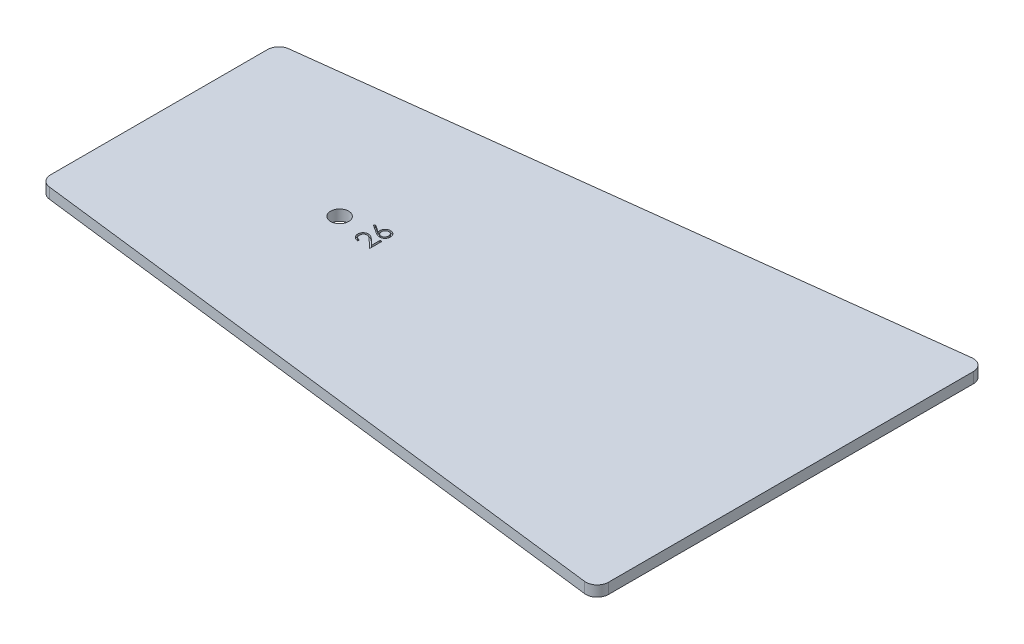
from build123d import *

# Parameters (mm, degrees)
BOSS_EXTRUDE1_DEPTH   = 5.9944
SKETCH2_R             = 5.08
CUT_EXTRUDE1_DEPTH    = 373.229628686
CUT_EXTRUDE2_DEPTH    = 1.27
FILLET1_R             = 6.35
BODY_MOVE_COPY1_ANGLE = 90


with BuildPart() as part:
    # Sketch1 → Boss-Extrude1 (new body)
    with BuildSketch(Plane(origin=(0, 0, 0), x_dir=(1, 0, 0), z_dir=(0, 1, 0))):
        Polygon((-66.675, 0), (66.675, 0), (109.852645123, -355.6), (-109.852645123, -355.6), align=None)
    extrude(amount=BOSS_EXTRUDE1_DEPTH)

    # Sketch2 → Cut-Extrude1 (cut, through all)
    with BuildSketch(Plane(origin=(0, 5.9944, 0), x_dir=(1, 0, 0), z_dir=(0, 1, 0))):
        with Locations(Location((0, -101.6, 0), (0, 0, 270))):
            Circle(SKETCH2_R)
    extrude(amount=-CUT_EXTRUDE1_DEPTH, mode=Mode.SUBTRACT)

    # Sketch3 → Cut-Extrude2 (cut)
    # profile 1 of 2: a face of its own
    with BuildSketch(Plane(origin=(0, 5.9944, 0), x_dir=(1, 0, 0), z_dir=(0, 1, 0))):
        with BuildLine():
            Line((-5.926666667, -118.696153846), (-6.838461538, -118.696153846))
            add(Edge.make_bspline(
                [(-6.838461538, -118.696153846), (-6.832518946, -118.575189212), (-6.820847852, -118.33761789), (-6.766192018, -117.991237636), (-6.6879865, -117.660152848), (-6.577412451, -117.347021898), (-6.440089084, -117.049076104), (-6.275409919, -116.767498915), (-6.08035577, -116.503364493), (-5.859138508, -116.259121451), (-5.618872973, -116.03505696), (-5.359630589, -115.841566312), (-5.087211881, -115.678084157), (-4.80244334, -115.541414038), (-4.502112104, -115.438827514), (-4.188943579, -115.36270984), (-3.861561858, -115.316913362), (-3.638506251, -115.311990739), (-3.525064103, -115.309487179)],
                knots=[0, 0, 0, 0, 1.10065271, 2.161652631, 3.183658789, 4.190468796, 5.17591951, 6.163126047, 7.15150782, 8.156236427, 9.156009102, 10.134482811, 11.092018607, 12.041330605, 13.001268258, 13.972401359, 14.968799086, 16, 16, 16, 16], degree=3))
            add(Edge.make_bspline(
                [(-3.525064103, -115.309487179), (-3.413658036, -115.31209527), (-3.194749095, -115.317220075), (-2.87525479, -115.361230377), (-2.571101273, -115.430160438), (-2.28288307, -115.526870332), (-2.012899751, -115.656873127), (-1.759123142, -115.813039696), (-1.518531988, -115.993654978), (-1.301959154, -116.206300334), (-1.103089987, -116.433310684), (-0.931524583, -116.675664141), (-0.7846018, -116.925975439), (-0.662136992, -117.186153305), (-0.571985457, -117.45864749), (-0.503541288, -117.739490799), (-0.46485371, -118.03159025), (-0.458916138, -118.229293851), (-0.455897436, -118.329807692)],
                knots=[0, 0, 0, 0, 1.111607364, 2.184268762, 3.212621178, 4.221274766, 5.211760367, 6.196651075, 7.1921475, 8.207485113, 9.220403448, 10.201281604, 11.166441695, 12.114753415, 13.065576456, 14.026450734, 14.996634279, 16, 16, 16, 16], degree=3))
            add(Edge.make_bspline(
                [(-0.455897436, -118.329807692), (-0.460812736, -118.471315692), (-0.47055708, -118.751848427), (-0.553910813, -119.164097285), (-0.684093828, -119.563511325), (-0.840840441, -119.884965893), (-0.998966164, -120.143997978), (-1.141460186, -120.357267133), (-1.308272324, -120.586899007), (-1.501830478, -120.832124649), (-1.718130701, -121.094864876), (-1.959132181, -121.374960968), (-2.226553489, -121.66951902), (-2.414247879, -121.87070328), (-2.51150641, -121.974951923)],
                knots=[0, 0, 0, 0, 1.184426356, 2.348067706, 3.509069118, 4.696110526, 5.333549288, 6.050745305, 6.844228056, 7.710549037, 8.667450064, 9.695053472, 10.805634456, 12, 12, 12, 12], degree=3))
            Line((-2.51150641, -121.974951923), (-5.053541667, -124.687948718))
            Line((-5.053541667, -124.687948718), (-0.325641026, -124.687948718))
            Line((-0.325641026, -124.687948718), (-0.325641026, -125.73))
            Line((-0.325641026, -125.73), (-7.229230769, -125.73))
            Line((-7.229230769, -125.73), (-3.288974359, -121.525160256))
            add(Edge.make_bspline(
                [(-3.288974359, -121.525160256), (-3.193041065, -121.425016601), (-3.00877284, -121.232661133), (-2.748146845, -120.951830141), (-2.514063382, -120.691300045), (-2.305007179, -120.451563093), (-2.125513346, -120.229112599), (-1.966227096, -120.031153117), (-1.838601266, -119.848985912), (-1.700090289, -119.637830302), (-1.565937703, -119.380020832), (-1.450658406, -119.064963037), (-1.380366161, -118.740634784), (-1.371933838, -118.521463156), (-1.367692308, -118.411217949)],
                knots=[0, 0, 0, 0, 1.329631726, 2.553950428, 3.673215718, 4.687767853, 5.603093632, 6.413772471, 7.123043292, 7.734684054, 8.834405432, 9.900288307, 10.943827018, 12, 12, 12, 12], degree=3))
            add(Edge.make_bspline(
                [(-1.367692308, -118.411217949), (-1.369537777, -118.341893661), (-1.373174842, -118.205268801), (-1.405273758, -118.004954941), (-1.45378197, -117.811726796), (-1.523291633, -117.624990004), (-1.615041485, -117.446622054), (-1.72672421, -117.276405826), (-1.855582223, -117.111845858), (-2.004647622, -116.957549427), (-2.168402205, -116.816234842), (-2.341395798, -116.691051783), (-2.524421244, -116.586435393), (-2.716706856, -116.500674841), (-2.917716561, -116.43340002), (-3.127839135, -116.386784258), (-3.346493994, -116.357516248), (-3.495798085, -116.353556251), (-3.571875, -116.351538462)],
                knots=[0, 0, 0, 0, 0.991446411, 1.95395049, 2.89581595, 3.838931463, 4.798493298, 5.75982156, 6.748411868, 7.785213223, 8.824556874, 9.840280684, 10.836137867, 11.835679398, 12.848801643, 13.863922112, 14.911575587, 16, 16, 16, 16], degree=3))
            add(Edge.make_bspline(
                [(-3.571875, -116.351538462), (-3.651328617, -116.353614098), (-3.807362403, -116.357690305), (-4.036453081, -116.386204096), (-4.254996938, -116.43539545), (-4.46354372, -116.502674024), (-4.662446289, -116.588187983), (-4.850737342, -116.694698876), (-5.027994187, -116.821796102), (-5.194550037, -116.965895546), (-5.348006616, -117.126329497), (-5.482835262, -117.305174418), (-5.600644857, -117.499164858), (-5.703432803, -117.707777382), (-5.786906464, -117.932904926), (-5.85069138, -118.173748321), (-5.901162913, -118.429261817), (-5.918024218, -118.605712234), (-5.926666667, -118.696153846)],
                knots=[0, 0, 0, 0, 1.031018746, 2.02475058, 2.990194455, 3.934040569, 4.864654155, 5.795059489, 6.735614925, 7.690564532, 8.649604399, 9.611025574, 10.590972636, 11.591080095, 12.624614302, 13.701020113, 14.821632451, 16, 16, 16, 16], degree=3))
        make_face()
    # profile 2 of 2: a face of its own
    with BuildSketch(Plane(origin=(0, 5.9944, 0), x_dir=(1, 0, 0), z_dir=(0, 1, 0))):
        with BuildLine():
            Line((5.275384615, -115.309487179), (5.977548077, -115.861041667))
            Line((5.977548077, -115.861041667), (3.293044872, -119.966153846))
            add(Edge.make_bspline(
                [(3.293044872, -119.966153846), (3.47177459, -119.937665611), (3.820407114, -119.882096086), (4.173295551, -119.872929022), (4.345272436, -119.868461538)],
                knots=[0, 0, 0, 0, 1.025318673, 2, 2, 2, 2], degree=3))
            add(Edge.make_bspline(
                [(4.345272436, -119.868461538), (4.448534311, -119.871236994), (4.651802239, -119.876700396), (4.950235699, -119.918744945), (5.237005868, -119.985002985), (5.510924148, -120.08158759), (5.772973718, -120.204965853), (6.024658388, -120.352834117), (6.26124708, -120.532827749), (6.485786503, -120.733894021), (6.689645734, -120.956592467), (6.870133941, -121.192888919), (7.021740857, -121.44253719), (7.144746298, -121.705410836), (7.24026446, -121.98110464), (7.309897166, -122.269265868), (7.351058499, -122.570093225), (7.356647923, -122.7746813), (7.359487179, -122.878605769)],
                knots=[0, 0, 0, 0, 1.04369286, 2.054478336, 3.041073146, 4.015093852, 4.984733326, 5.965804835, 6.960378782, 7.985147595, 9.009457201, 10.008161701, 10.986880575, 11.956520048, 12.937015923, 13.931873656, 14.949455224, 16, 16, 16, 16], degree=3))
            add(Edge.make_bspline(
                [(7.359487179, -122.878605769), (7.355356109, -123.020786853), (7.347227141, -123.300565577), (7.266226407, -123.708059102), (7.140359553, -124.09626549), (6.960447642, -124.458986696), (6.736978781, -124.795725583), (6.464465541, -125.094097106), (6.152572443, -125.360202128), (5.799913624, -125.582725343), (5.420385476, -125.764453057), (5.02167225, -125.894980731), (4.607646019, -125.975341888), (4.326636071, -125.985416552), (4.184487179, -125.990512821)],
                knots=[0, 0, 0, 0, 1.031375318, 2.029502543, 3.004789286, 3.987476834, 4.960371455, 5.9300674, 6.912260825, 7.929083631, 8.949397511, 9.960523116, 10.96833055, 12, 12, 12, 12], degree=3))
            add(Edge.make_bspline(
                [(4.184487179, -125.990512821), (4.047772186, -125.986076658), (3.77696372, -125.977289395), (3.378596523, -125.89901113), (2.995817021, -125.772135655), (2.631307047, -125.597342206), (2.293644924, -125.376557037), (1.991557248, -125.110764821), (1.726550269, -124.80564706), (1.506006798, -124.46125108), (1.331084307, -124.091165946), (1.19990441, -123.705268373), (1.123279887, -123.304964426), (1.112572533, -123.033602033), (1.107179487, -122.896923077)],
                knots=[0, 0, 0, 0, 1.012016664, 2.004627821, 2.994792927, 3.992885782, 4.990978636, 5.973936114, 6.964471063, 7.975201453, 8.993600317, 9.990122807, 10.98767138, 12, 12, 12, 12], degree=3))
            add(Edge.make_bspline(
                [(1.107179487, -122.896923077), (1.110609053, -122.792290801), (1.117611572, -122.578651686), (1.166505528, -122.255087536), (1.245070761, -121.924013539), (1.333057076, -121.643149937), (1.426022847, -121.413065061), (1.503391362, -121.227562357), (1.599690733, -121.036667356), (1.702374605, -120.833834173), (1.820685973, -120.624290174), (1.949327973, -120.404533236), (2.091857245, -120.178058338), (2.19177406, -120.024368902), (2.242852564, -119.945801282)],
                knots=[0, 0, 0, 0, 1.173818275, 2.396712641, 3.66331629, 4.989737886, 5.693666774, 6.447286557, 7.243889047, 8.091586357, 8.998013824, 9.943181721, 10.948533338, 12, 12, 12, 12], degree=3))
            Line((2.242852564, -119.945801282), (5.275384615, -115.309487179))
        make_face()
        with BuildLine():
            add(Edge.make_bspline(
                [(4.153958333, -120.910512821), (4.076561645, -120.91277137), (3.925383431, -120.917182974), (3.703583621, -120.942801419), (3.493668583, -120.991044193), (3.292857246, -121.052487031), (3.104903914, -121.136969055), (2.928442596, -121.239590277), (2.762790903, -121.360410612), (2.609683907, -121.497718399), (2.470870256, -121.648051661), (2.351327316, -121.809071759), (2.248210863, -121.976898132), (2.164371069, -122.152933027), (2.099085592, -122.337109151), (2.051861184, -122.52857943), (2.025579437, -122.728627815), (2.021207062, -122.864285595), (2.018974359, -122.933557692)],
                knots=[0, 0, 0, 0, 1.129588631, 2.206414736, 3.251139165, 4.268635594, 5.265702196, 6.250456724, 7.242448911, 8.251968645, 9.246821453, 10.222880186, 11.173611482, 12.116736599, 13.062300278, 14.020270554, 14.989073742, 16, 16, 16, 16], degree=3))
            add(Edge.make_bspline(
                [(2.018974359, -122.933557692), (2.020792597, -123.002210205), (2.024357891, -123.136827563), (2.056731482, -123.335206439), (2.106181892, -123.526112573), (2.179741442, -123.708561785), (2.26748578, -123.885335097), (2.383325235, -124.050029526), (2.511680248, -124.212647786), (2.665107666, -124.360697772), (2.829767485, -124.498457572), (3.005684119, -124.618868823), (3.18902846, -124.721880114), (3.382275788, -124.802611758), (3.582684354, -124.868867402), (3.791923905, -124.915491582), (4.010139966, -124.941851051), (4.157959077, -124.946229122), (4.233333333, -124.948461538)],
                knots=[0, 0, 0, 0, 0.989467248, 1.94019797, 2.891935182, 3.827694429, 4.772920941, 5.730924762, 6.725747692, 7.756678648, 8.79901574, 9.819492441, 10.826891316, 11.826466727, 12.835195252, 13.867842842, 14.912794438, 16, 16, 16, 16], degree=3))
            add(Edge.make_bspline(
                [(4.233333333, -124.948461538), (4.308707466, -124.946228947), (4.456526336, -124.941850533), (4.674744151, -124.915493552), (4.883977214, -124.868860174), (5.084409364, -124.80263796), (5.277569633, -124.721782911), (5.460753624, -124.619509681), (5.635006604, -124.497717065), (5.799774516, -124.360933193), (5.95256332, -124.211805143), (6.083996793, -124.051481149), (6.196288692, -123.884004013), (6.287537647, -123.709258138), (6.360286995, -123.526002254), (6.409988169, -123.335235993), (6.442294905, -123.136819826), (6.445869385, -123.002207592), (6.447692308, -122.933557692)],
                knots=[0, 0, 0, 0, 1.087397944, 2.132534446, 3.165364764, 4.174271784, 5.174024072, 6.181601208, 7.194203697, 8.236725232, 9.267838612, 10.269026844, 11.221737037, 12.171628256, 13.107553087, 14.05945871, 15.010357665, 16, 16, 16, 16], degree=3))
            add(Edge.make_bspline(
                [(6.447692308, -122.933557692), (6.446094886, -122.864195225), (6.442959666, -122.728059258), (6.407498512, -122.528668915), (6.358317221, -122.336136316), (6.284053338, -122.151671504), (6.187572397, -121.976002413), (6.070054849, -121.808241651), (5.934106588, -121.647103043), (5.777069159, -121.497423576), (5.606119223, -121.360562344), (5.424355123, -121.239746718), (5.234194834, -121.137783928), (5.035831161, -121.052709597), (4.82699125, -120.991315695), (4.611046723, -120.94297371), (4.385235664, -120.917248538), (4.23203271, -120.912786657), (4.153958333, -120.910512821)],
                knots=[0, 0, 0, 0, 0.978206639, 1.919901502, 2.851605144, 3.780102724, 4.718870031, 5.675451981, 6.667674623, 7.690630536, 8.733308323, 9.756129687, 10.767539656, 11.776269907, 12.797430371, 13.836405707, 14.897401972, 16, 16, 16, 16], degree=3))
        make_face(mode=Mode.SUBTRACT)
    extrude(amount=-CUT_EXTRUDE2_DEPTH, mode=Mode.SUBTRACT)

    # Fillet1
    fillet1_edges = [part.edges().sort_by_distance(p)[0] for p in [
        (109.852645123, 2.9972, 355.6),
        (-109.852645123, 2.9972, 355.6),
        (-66.675, 2.9972, 0),
        (66.675, 2.9972, 0),
    ]]
    fillet(fillet1_edges, radius=FILLET1_R)


with BuildPart() as part_1:
    # Body-Move/Copy1: moved
    add(part.part.rotate(Axis((0, 0, 177.8), (0, 1, 0)), BODY_MOVE_COPY1_ANGLE))


solid = part_1.part
